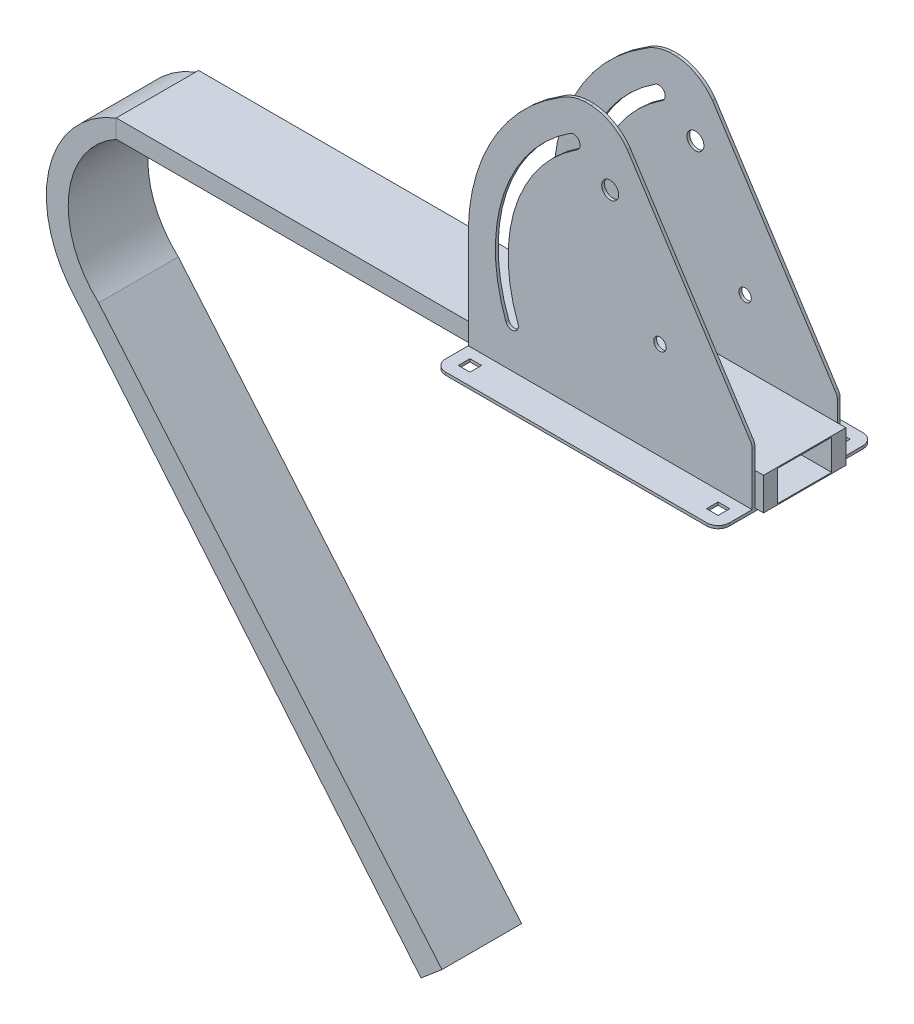
from build123d import *

# Parameters (mm, degrees)
CROQUIS1_W                   = 200
CROQUIS1_H                   = 110
CROQUIS1_W_2                 = 183
CROQUIS1_H_2                 = 93
CROQUIS1_W_3                 = 166.6
CROQUIS1_H_3                 = 8.2
CROQUIS1_H_4                 = 76.6
CROQUIS1_W_4                 = 8.2
SALIENTE_EXTRUIR1_DEPTH      = 2
CORTAR_EXTRUIR1_DEPTH        = 2
CROQUIS3_W                   = 200
CROQUIS3_H                   = 2
SALIENTE_EXTRUIR2_DEPTH      = 190
CROQUIS4_R                   = 4.35
CORTAR_EXTRUIR2_DEPTH        = 81
CROQUIS5_W                   = 250
CROQUIS5_H                   = 58
CROQUIS5_W_2                 = 200
CROQUIS5_W_3                 = 6
SALIENTE_EXTRUIR3_DEPTH      = 13
SALIENTE_EXTRUIR4_DEPTH      = 0.1
SALIENTE_EXTRUIR4_DEPTH_BACK = 56
CROQUIS7_R                   = 6
CORTAR_EXTRUIR3_DEPTH        = 80.1
CROQUIS10_W                  = 149.116642103
CROQUIS10_H                  = 58
SALIENTE_EXTRUIR5_DEPTH      = 10
CROQUIS11_W                  = 38
CROQUIS11_H                  = 21.5
CORTAR_EXTRUIR4_DEPTH        = 70


with BuildPart() as part:
    # Croquis1 → Saliente-Extruir1 (new body)
    # profile 1 of 6: a face of its own
    with BuildSketch(Plane(origin=(0, 0, 0), x_dir=(1, 0, 0), z_dir=(0, 1, 0))):
        Rectangle(CROQUIS1_W, CROQUIS1_H)
        Rectangle(CROQUIS1_W_2, CROQUIS1_H_2, mode=Mode.SUBTRACT)
    # profile 2 of 6: a face of its own
    with BuildSketch(Plane(origin=(0, 0, 0), x_dir=(1, 0, 0), z_dir=(0, 1, 0))):
        with Locations((0, 42.4)):
            Rectangle(CROQUIS1_W_3, CROQUIS1_H_3)
    # profile 3 of 6: a face of its own
    with BuildSketch(Plane(origin=(0, 0, 0), x_dir=(1, 0, 0), z_dir=(0, 1, 0))):
        Rectangle(CROQUIS1_W_3, CROQUIS1_H_4)
    # profile 4 of 6: a face of its own
    with BuildSketch(Plane(origin=(0, 0, 0), x_dir=(1, 0, 0), z_dir=(0, 1, 0))):
        with Locations((-87.4, 0)):
            Rectangle(CROQUIS1_W_4, CROQUIS1_H_4)
    # profile 5 of 6: a face of its own
    with BuildSketch(Plane(origin=(0, 0, 0), x_dir=(1, 0, 0), z_dir=(0, 1, 0))):
        with Locations((0, -42.4)):
            Rectangle(CROQUIS1_W_3, CROQUIS1_H_3)
    # profile 6 of 6: a face of its own
    with BuildSketch(Plane(origin=(0, 0, 0), x_dir=(1, 0, 0), z_dir=(0, 1, 0))):
        with Locations((87.4, 0)):
            Rectangle(CROQUIS1_W_4, CROQUIS1_H_4)
    extrude(amount=SALIENTE_EXTRUIR1_DEPTH)

    # Croquis2 → Cortar-Extruir1 (cut)
    with BuildSketch(Plane(origin=(0, 2, 0), x_dir=(1, 0, 0), z_dir=(0, 1, 0))):
        with BuildLine():
            ThreePointArc((-100, 47), (-97.656854249, 52.656854249), (-92, 55))
            Line((-92, 55), (-100, 55))
            Line((-100, 55), (-100, 47))
        make_face()
        with BuildLine():
            ThreePointArc((-92, -55), (-97.656854249, -52.656854249), (-100, -47))
            Line((-100, -47), (-100, -55))
            Line((-100, -55), (-92, -55))
        make_face()
        with BuildLine():
            Line((100, -55), (100, -47))
            ThreePointArc((100, -47), (97.656854249, -52.656854249), (92, -55))
            Line((92, -55), (100, -55))
        make_face()
        with BuildLine():
            Line((100, 55), (92, 55))
            ThreePointArc((92, 55), (97.656854249, 52.656854249), (100, 47))
            Line((100, 47), (100, 55))
        make_face()
    extrude(amount=-CORTAR_EXTRUIR1_DEPTH, mode=Mode.SUBTRACT)

    # Croquis3 → Saliente-Extruir2 (add)
    with BuildSketch(Plane(origin=(0, 2, 0), x_dir=(1, 0, 0), z_dir=(0, 1, 0))):
        with Locations((0, -30)):
            Rectangle(CROQUIS3_W, CROQUIS3_H)
        with Locations((0, 30)):
            Rectangle(CROQUIS3_W, CROQUIS3_H)
    extrude(amount=SALIENTE_EXTRUIR2_DEPTH)

    # Croquis4 → Cortar-Extruir2 (cut)
    with BuildSketch(Plane.XY.offset(31)):
        with BuildLine():
            ThreePointArc((-35.907198592, 185.411223689), (-27.45094246, 189.983179116), (-18.051821346, 192))
            Line((-18.051821346, 192), (-100, 192))
            Line((-100, 192), (-100, 73.004085605))
            ThreePointArc((-100, 73.004085605), (-82.293244846, 137.383897456), (-35.907198592, 185.411223689))
        make_face()
        with BuildLine():
            Line((12.058102776, 177.657452596), (98.130373638, 44.243495367))
            ThreePointArc((98.130373638, 44.243495367), (99.51807785, 41.83828614), (100, 39.103600519))
            Line((100, 39.103600519), (100, 192))
            Line((100, 192), (-13.35732151, 192))
            ThreePointArc((-13.35732151, 192), (0.971130931, 187.700726729), (12.058102776, 177.657452596))
        make_face()
        with Locations((35.02020603, 70.493592822)):
            Circle(CROQUIS4_R)
        with BuildLine():
            ThreePointArc((-28.192006816, 167.49912775), (-75.165619507, 106.707118451), (-73.438142939, 29.900839356))
            ThreePointArc((-73.438142939, 29.900839356), (-67.634394225, 27.289996416), (-65.023551285, 33.093745131))
            ThreePointArc((-65.023551285, 33.093745131), (-66.615983893, 103.895760975), (-23.31449202, 159.935408465))
            ThreePointArc((-23.31449202, 159.935408465), (-21.971389776, 166.156025506), (-28.192006816, 167.49912775))
        make_face()
    extrude(amount=-CORTAR_EXTRUIR2_DEPTH, mode=Mode.SUBTRACT)

    # Croquis5 → Saliente-Extruir3 (add)
    with BuildSketch(Plane(origin=(0, 2, 0), x_dir=(1, 0, 0), z_dir=(0, 1, 0))):
        with Locations((-225, 0)):
            Rectangle(CROQUIS5_W, CROQUIS5_H)
        Rectangle(CROQUIS5_W_2, CROQUIS5_H)
        with Locations((103, 0)):
            Rectangle(CROQUIS5_W_3, CROQUIS5_H)
    extrude(amount=SALIENTE_EXTRUIR3_DEPTH)

    # Croquis6 → Saliente-Extruir4 (add, two sides: drawn at the far end of the back side and taken through both)
    with BuildSketch(Plane.XY.offset(29).offset(-SALIENTE_EXTRUIR4_DEPTH_BACK)):
        with BuildLine():
            Line((-383.123851027, -103.888519267), (-135.216927507, -402.269059015))
            Line((-135.216927507, -402.269059015), (-120.435481517, -389.763884447))
            Line((-120.435481517, -389.763884447), (-362.287418648, -103.888519267))
            ThreePointArc((-362.287418648, -103.888519267), (-383.304553722, -47.792485784), (-350, 2))
            Line((-350, 2), (-350, 15))
            ThreePointArc((-350, 15), (-396.30683482, -36.156950221), (-383.123851027, -103.888519267))
        make_face()
    extrude(amount=SALIENTE_EXTRUIR4_DEPTH + SALIENTE_EXTRUIR4_DEPTH_BACK)

    # Croquis7 → Cortar-Extruir3 (cut)
    with BuildSketch(Plane(origin=(0, 0, -31), x_dir=(-1, 0, 0), z_dir=(0, 0, -1))):
        with Locations((0, 147)):
            Circle(CROQUIS7_R)
    extrude(amount=-CORTAR_EXTRUIR3_DEPTH, mode=Mode.SUBTRACT)

    # Croquis10 → Saliente-Extruir5 (add)
    with BuildSketch(Plane(origin=(0, 15, 0), x_dir=(1, 0, 0), z_dir=(0, 1, 0))):
        with Locations((31.441678948, 0)):
            Rectangle(CROQUIS10_W, CROQUIS10_H)
    extrude(amount=SALIENTE_EXTRUIR5_DEPTH)

    # Croquis11 → Cortar-Extruir4 (cut)
    with BuildSketch(Plane(origin=(106, 0, 0), x_dir=(0, 0, -1), z_dir=(1, 0, 0))):
        with Locations((0, 13.5)):
            Rectangle(CROQUIS11_W, CROQUIS11_H)
    extrude(amount=-CORTAR_EXTRUIR4_DEPTH, mode=Mode.SUBTRACT)


solid = part.part
